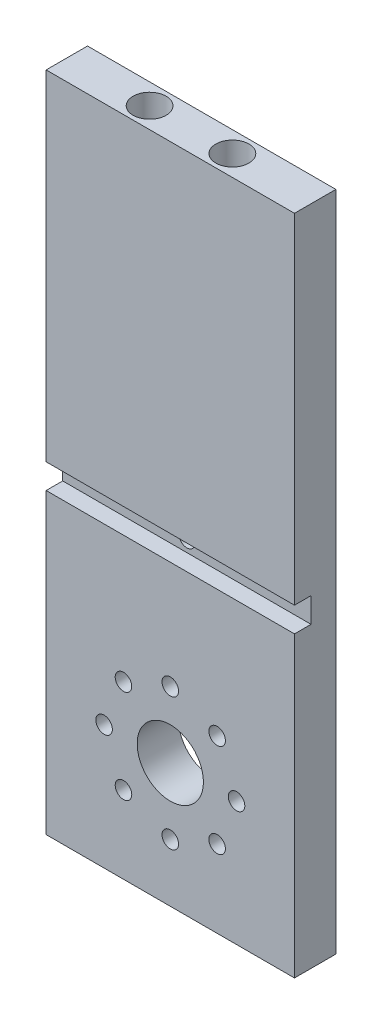
from build123d import *

# Parameters (mm, degrees)
SKETCH1_W           = 30
SKETCH1_H           = 5
BOSS_EXTRUDE1_DEPTH = 80
SKETCH2_R           = 2
CUT_EXTRUDE1_DEPTH  = 10
SKETCH3_R           = 1
SKETCH3_R_2         = 4
CUT_EXTRUDE3_DEPTH  = 82.547532152
SKETCH5_W           = 30
SKETCH5_H           = 3
CUT_EXTRUDE4_DEPTH  = 2
SKETCH6_R           = 1
CUT_EXTRUDE5_DEPTH  = 82.449370777


with BuildPart() as part:
    # Sketch1 → Boss-Extrude1 (new body)
    with BuildSketch(Plane(origin=(0, 0, 0), x_dir=(1, 0, 0), z_dir=(0, 1, 0))):
        Rectangle(SKETCH1_W, SKETCH1_H)
    extrude(amount=BOSS_EXTRUDE1_DEPTH)

    # Sketch2 → Cut-Extrude1 (cut)
    with BuildSketch(Plane(origin=(0, 80, 0), x_dir=(1, 0, 0), z_dir=(0, 1, 0))):
        with Locations((-5, 0)):
            Circle(SKETCH2_R)
        with Locations((5, 0)):
            Circle(SKETCH2_R)
    extrude(amount=-CUT_EXTRUDE1_DEPTH, mode=Mode.SUBTRACT)

    # Sketch3 → Cut-Extrude3 (cut, through all)
    with BuildSketch(Plane.XY.offset(2.5)):
        with Locations((0, 23)):
            Circle(SKETCH3_R)
        with Locations((-5.656854249, 20.656854249)):
            Circle(SKETCH3_R)
        with Locations((0, 15)):
            Circle(SKETCH3_R_2)
        with Locations((5.656854249, 20.656854249)):
            Circle(SKETCH3_R)
        with Locations((-8, 15)):
            Circle(SKETCH3_R)
        with Locations((0, 7)):
            Circle(SKETCH3_R)
        with Locations((8, 15)):
            Circle(SKETCH3_R)
        with Locations((-5.656854249, 9.343145751)):
            Circle(SKETCH3_R)
        with Locations((5.656854249, 9.343145751)):
            Circle(SKETCH3_R)
    extrude(amount=-CUT_EXTRUDE3_DEPTH, mode=Mode.SUBTRACT)

    # Sketch5 → Cut-Extrude4 (cut)
    with BuildSketch(Plane.XY.offset(2.5)):
        with Locations((0, 37.5)):
            Rectangle(SKETCH5_W, SKETCH5_H)
    extrude(amount=-CUT_EXTRUDE4_DEPTH, mode=Mode.SUBTRACT)

    # Sketch6 → Cut-Extrude5 (cut, through all)
    with BuildSketch(Plane.XY.offset(0.5)):
        with Locations((0, 37.5)):
            Circle(SKETCH6_R)
    extrude(amount=-CUT_EXTRUDE5_DEPTH, mode=Mode.SUBTRACT)


solid = part.part
